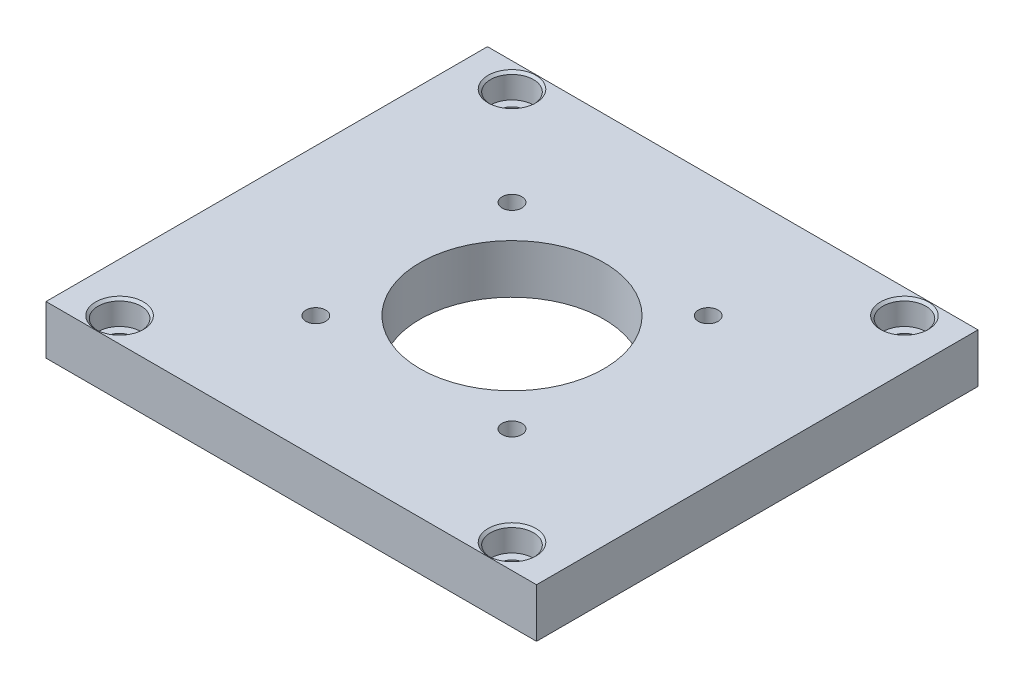
from build123d import *

# Parameters (mm, degrees)
SKETCH1_W                                     = 127
SKETCH1_H                                     = 114.3
BOSS_EXTRUDE1_DEPTH                           = 12.7
SKETCH2_R                                     = 23.8125
CUT_EXTRUDE1_DEPTH                            = 87.36933773
CBORE_FOR_1_4_SOCKET_HEAD_CAP_SCREW1_AT_COUNT = 2
CBORE_FOR_1_4_SOCKET_HEAD_CAP_SCREW1_AT_PITCH = 101.6
CBORE_FOR_1_4_SOCKET_HEAD_CAP_SCREW1_2_COUNT  = 2
CBORE_FOR_1_4_SOCKET_HEAD_CAP_SCREW1_2_PITCH  = 143.684097937
CBORE_FOR_1_4_SOCKET_HEAD_CAP_SCREW1_3_COUNT  = 2
CBORE_FOR_1_4_SOCKET_HEAD_CAP_SCREW1_3_PITCH  = 101.6
F_1_4_20_TAPPED_HOLE1_D                       = 5.1054
F_1_4_20_TAPPED_HOLE1_DEPTH                   = 16.51
F_1_4_20_TAPPED_HOLE1_TIP                     = 1.533816902


with BuildPart() as part:
    # Sketch1 → Boss-Extrude1 (new body)
    with BuildSketch(Plane(origin=(0, 0, 0), x_dir=(1, 0, 0), z_dir=(0, 1, 0))):
        Rectangle(SKETCH1_W, SKETCH1_H)
    extrude(amount=BOSS_EXTRUDE1_DEPTH)

    # Sketch2 → Cut-Extrude1 (cut, through all)
    with BuildSketch(Plane(origin=(0, 12.7, 0), x_dir=(1, 0, 0), z_dir=(0, 1, 0))):
        with Locations(Location((0, 0, 0), (0, 0, 270))):
            Circle(SKETCH2_R)
    extrude(amount=-CUT_EXTRUDE1_DEPTH, mode=Mode.SUBTRACT)

    # Sketch5 → CBORE for 1/4 Socket Head Cap Screw1 (revolve, cut)
    with BuildSketch(Plane(origin=(-50.8, 12.7, -50.8), x_dir=(0, 0, 1), z_dir=(1, 0, 0))):
        Polygon((0, 0), (0, 12.7), (3.3782, 12.7), (3.3782, 6.35), (5.55625, 6.35), (5.55625, 0.635), (6.19125, 0), align=None)
    cbore_for_1_4_socket_head_cap_screw1 = revolve(axis=Axis((-50.8, 19.05, -50.8), (0, -1, 0)), mode=Mode.SUBTRACT)

    # CBORE for 1/4 Socket Head Cap Screw1 at: CBORE for 1/4 Socket Head Cap Screw1 ×2
    with Locations(*[(i * CBORE_FOR_1_4_SOCKET_HEAD_CAP_SCREW1_AT_PITCH, 0, 0) for i in range(1, CBORE_FOR_1_4_SOCKET_HEAD_CAP_SCREW1_AT_COUNT)]):
        add(cbore_for_1_4_socket_head_cap_screw1, mode=Mode.SUBTRACT)

    # CBORE for 1_4 Socket Head Cap Screw1 2: CBORE for 1/4 Socket Head Cap Screw1 ×2
    with Locations(*[Vector(0.7071067811865476, 0, 0.7071067811865475) * (i * CBORE_FOR_1_4_SOCKET_HEAD_CAP_SCREW1_2_PITCH) for i in range(1, CBORE_FOR_1_4_SOCKET_HEAD_CAP_SCREW1_2_COUNT)]):
        add(cbore_for_1_4_socket_head_cap_screw1, mode=Mode.SUBTRACT)

    # CBORE for 1_4 Socket Head Cap Screw1 3: CBORE for 1/4 Socket Head Cap Screw1 ×2
    with Locations(*[(0, 0, i * CBORE_FOR_1_4_SOCKET_HEAD_CAP_SCREW1_3_PITCH) for i in range(1, CBORE_FOR_1_4_SOCKET_HEAD_CAP_SCREW1_3_COUNT)]):
        add(cbore_for_1_4_socket_head_cap_screw1, mode=Mode.SUBTRACT)

    # 1/4-20 Tapped Hole1
    with Locations(Plane(origin=(-25.4, 12.7, -25.4), x_dir=(0, 0, 1), z_dir=(0, 1, 0))):
        with Locations((0, 0), (0, 50.8), (50.8, 50.8), (50.8, 0)):
            Hole(F_1_4_20_TAPPED_HOLE1_D / 2, depth=F_1_4_20_TAPPED_HOLE1_DEPTH)
            with Locations((0, 0, -(F_1_4_20_TAPPED_HOLE1_DEPTH + F_1_4_20_TAPPED_HOLE1_TIP / 2))):  # 118° drill point
                Cone(0, F_1_4_20_TAPPED_HOLE1_D / 2, F_1_4_20_TAPPED_HOLE1_TIP, mode=Mode.SUBTRACT)


solid = part.part
